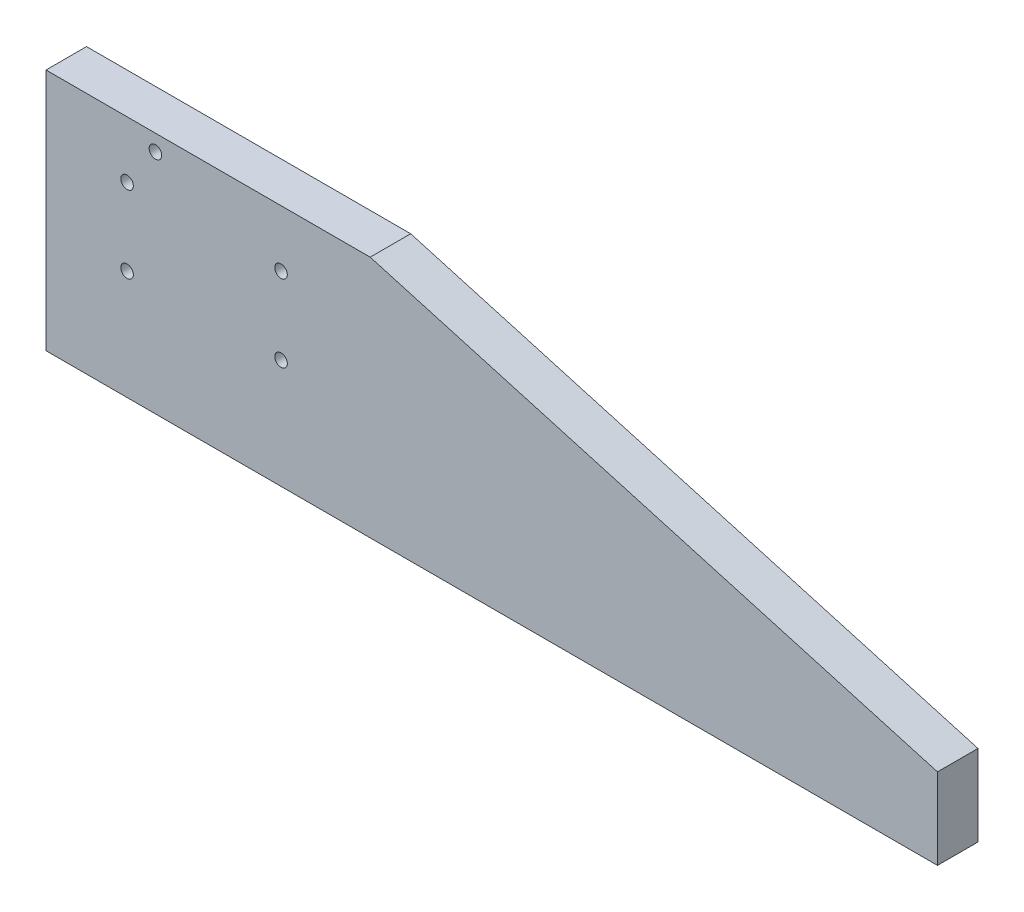
from build123d import *

# Parameters (mm, degrees)
BOSS_EXTRUDE1_DEPTH = 10
SKETCH2_R           = 1.55
CUT_EXTRUDE1_DEPTH  = 115.455231423
CUT_EXTRUDE2_REACH  = 116.455
SKETCH3_R           = 1.55


with BuildPart() as part:
    # Sketch1 → Boss-Extrude1 (new body)
    with BuildSketch(Plane.XY):
        Polygon((110, -30), (110, -10), (-30, 30), (-110, 30), (-110, -30), align=None)
    extrude(amount=BOSS_EXTRUDE1_DEPTH)

    # Sketch2 → Cut-Extrude1 (cut, through all)
    with BuildSketch(Plane.XY.offset(10)):
        with Locations((-90, 16)):
            Circle(SKETCH2_R)
        with Locations((-52, 16)):
            Circle(SKETCH2_R)
        with Locations((-90, -3)):
            Circle(SKETCH2_R)
        with Locations((-52, -3)):
            Circle(SKETCH2_R)
    extrude(amount=-CUT_EXTRUDE1_DEPTH, mode=Mode.SUBTRACT)

    # Sketch3 → Cut-Extrude2 (cut, up to next)
    with BuildSketch(Plane.XY.offset(10), mode=Mode.PRIVATE) as cut_extrude2_sk1:
        with Locations((-83, 26)):
            Circle(SKETCH3_R)
    cut_extrude2_tool1 = extrude(cut_extrude2_sk1.sketch, amount=-CUT_EXTRUDE2_REACH, mode=Mode.PRIVATE) & part.part
    add(cut_extrude2_tool1.solids().sort_by_distance((-83, 26, 10))[0], mode=Mode.SUBTRACT)


solid = part.part
